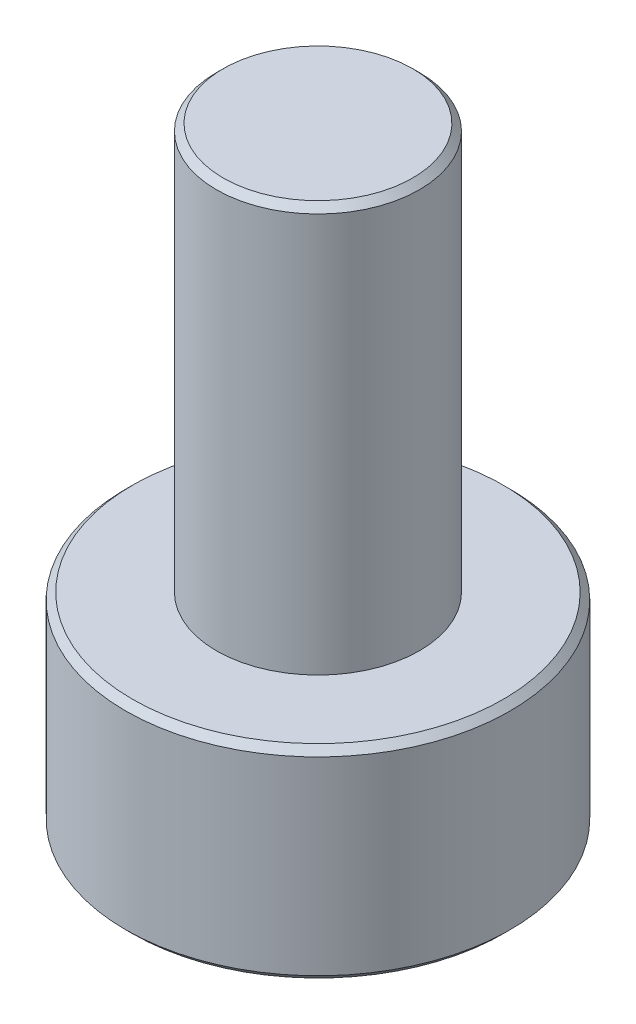
from build123d import *

# Parameters (mm, degrees)
SKETCH_1_R            = 2.84
EXTRUDE_261_DEPTH     = 3
SKETCH_2_R            = 1.5
EXTRUDE_346_DEPTH     = 6
CUT_EXTRUDE_531_DEPTH = 1.3
CHAMFER_593_SIZE      = 0.1


with BuildPart() as part:
    # 草图1 → Extrude 261 (new body)
    with BuildSketch(Plane(origin=(0, 0, 0), x_dir=(1, 0, 0), z_dir=(0, 1, 0))):
        with Locations(Location((0, 0, 0), (0, 0, 270))):
            Circle(SKETCH_1_R)
    extrude(amount=EXTRUDE_261_DEPTH)

    # 草图2 → Extrude 346 (add)
    with BuildSketch(Plane(origin=(0, 3, 0), x_dir=(1, 0, 0), z_dir=(0, 1, 0))):
        with Locations(Location((0, 0, 0), (0, 0, 270))):
            Circle(SKETCH_2_R)
    extrude(amount=EXTRUDE_346_DEPTH)

    # 草图3 → Cut-Extrude 531 (cut)
    with BuildSketch(Plane.XZ):
        Polygon((1.29, -0.744781847), (1.29, 0.744781847), (0, 1.489563695), (-1.29, 0.744781847), (-1.29, -0.744781847), (0, -1.489563695), align=None)
    extrude(amount=-CUT_EXTRUDE_531_DEPTH, mode=Mode.SUBTRACT)

    # Chamfer 593
    chamfer_593_edges = [part.edges().sort_by_distance(p)[0] for p in [
        (0, 0, -2.84),
        (0, 3, -2.84),
        (0, 9, -1.5),
    ]]
    chamfer(chamfer_593_edges, length=CHAMFER_593_SIZE)


solid = part.part
